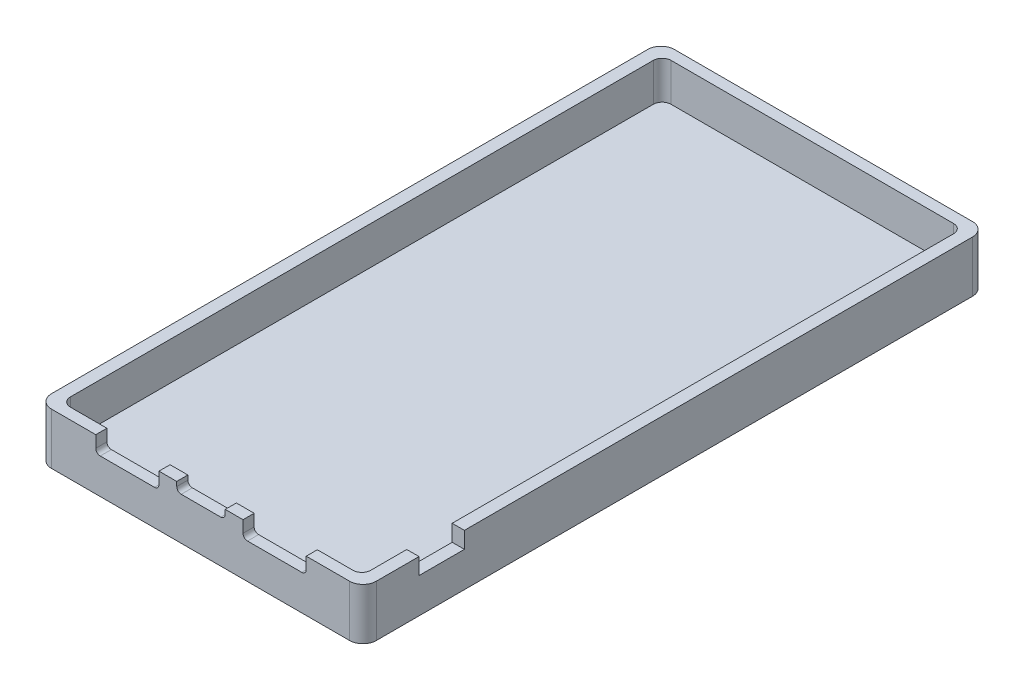
from build123d import *

# Parameters (mm, degrees)
SKETCH1_W           = 73
SKETCH1_H           = 140
BOSS_EXTRUDE1_DEPTH = 16
SKETCH2_W           = 67.5
SKETCH2_H           = 135
CUT_EXTRUDE1_DEPTH  = 13
SKETCH3_W           = 14.2
SKETCH3_H           = 6.45
SKETCH3_W_2         = 10.9
SKETCH3_H_2         = 4.8
CUT_EXTRUDE2_DEPTH  = 2.5
FILLET1_R           = 3
SKETCH4_W           = 10.2
SKETCH4_H           = 5.5
CUT_EXTRUDE3_DEPTH  = 2.75
FILLET2_R           = 1
FILLET3_R           = 1
FILLET4_R           = 2
CHAMFER1_SIZE       = 1
SKETCH6_W           = 92.196914974
SKETCH6_H           = 18.56524909
CUT_EXTRUDE4_DEPTH  = 159.697826072


with BuildPart() as part:
    # Sketch1 → Boss-Extrude1 (new body)
    with BuildSketch(Plane(origin=(0, 0, 0), x_dir=(1, 0, 0), z_dir=(0, 1, 0))):
        with Locations((36.5, 70)):
            Rectangle(SKETCH1_W, SKETCH1_H)
    extrude(amount=BOSS_EXTRUDE1_DEPTH)

    # Sketch2 → Cut-Extrude1 (cut)
    with BuildSketch(Plane(origin=(0, 16, 0), x_dir=(1, 0, 0), z_dir=(0, 1, 0))):
        with Locations((36.5, 70)):
            Rectangle(SKETCH2_W, SKETCH2_H)
    extrude(amount=-CUT_EXTRUDE1_DEPTH, mode=Mode.SUBTRACT)

    # Sketch3 → Cut-Extrude2 (cut)
    with BuildSketch(Plane.XY):
        with Locations((20.05, 11.125)):
            Rectangle(SKETCH3_W, SKETCH3_H)
        with Locations((36.6, 11.95)):
            Rectangle(SKETCH3_W_2, SKETCH3_H_2)
        with Locations((53.15, 11.125)):
            Rectangle(SKETCH3_W, SKETCH3_H)
    extrude(amount=-CUT_EXTRUDE2_DEPTH, mode=Mode.SUBTRACT)

    # Fillet1
    fillet1_edges = [part.edges().sort_by_distance(p)[0] for p in [
        (0, 8, -140),
        (73, 8, -140),
        (73, 8, 0),
        (0, 8, 0),
    ]]
    fillet(fillet1_edges, radius=FILLET1_R)

    # Sketch4 → Cut-Extrude3 (cut)
    with BuildSketch(Plane(origin=(73, 0, 0), x_dir=(0, 0, -1), z_dir=(1, 0, 0))):
        with Locations((17.7, 10.6)):
            Rectangle(SKETCH4_W, SKETCH4_H)
    extrude(amount=-CUT_EXTRUDE3_DEPTH, mode=Mode.SUBTRACT)

    # Fillet2
    fillet2_edges = [part.edges().sort_by_distance(p)[0] for p in [
        (27.15, 14.35, -1.25),
        (27.15, 7.9, -1.25),
        (12.95, 7.9, -1.25),
        (12.95, 14.35, -1.25),
        (31.15, 9.55, -1.25),
        (31.15, 14.35, -1.25),
        (42.05, 14.35, -1.25),
        (42.05, 9.55, -1.25),
        (60.25, 7.9, -1.25),
        (46.05, 7.9, -1.25),
        (46.05, 14.35, -1.25),
        (60.25, 14.35, -1.25),
    ]]
    fillet(fillet2_edges, radius=FILLET2_R)

    # Fillet3
    fillet3_edges = [part.edges().sort_by_distance(p)[0] for p in [
        (0, 16, -70),
        (36.5, 16, -140),
        (36.5, 16, 0),
        (73, 16, -70),
        (0.878679656, 16, -0.878679656),
        (72.121320344, 16, -0.878679656),
        (72.121320344, 16, -139.121320344),
        (0.878679656, 16, -139.121320344),
    ]]
    fillet(fillet3_edges, radius=FILLET3_R)

    # Fillet4
    fillet4_edges = [part.edges().sort_by_distance(p)[0] for p in [
        (2.75, 9.5, -2.5),
        (2.75, 9.5, -137.5),
        (70.25, 9.5, -137.5),
        (70.25, 9.5, -2.5),
    ]]
    fillet(fillet4_edges, radius=FILLET4_R)

    # Chamfer1
    chamfer1_edges = [part.edges().sort_by_distance(p)[0] for p in [
        (70.25, 16, -70),
        (36.5, 16, -2.5),
        (36.5, 16, -137.5),
        (2.75, 16, -70),
        (69.664213562, 16, -3.085786438),
        (69.664213562, 16, -136.914213562),
        (3.335786438, 16, -136.914213562),
        (3.335786438, 16, -3.085786438),
    ]]
    chamfer(chamfer1_edges, length=CHAMFER1_SIZE)

    # Sketch6 → Cut-Extrude4 (cut, through all)
    with BuildSketch(Plane.XY):
        with Locations((35.320005354, 20.832624545)):
            Rectangle(SKETCH6_W, SKETCH6_H)
    extrude(amount=-CUT_EXTRUDE4_DEPTH, mode=Mode.SUBTRACT)


solid = part.part
